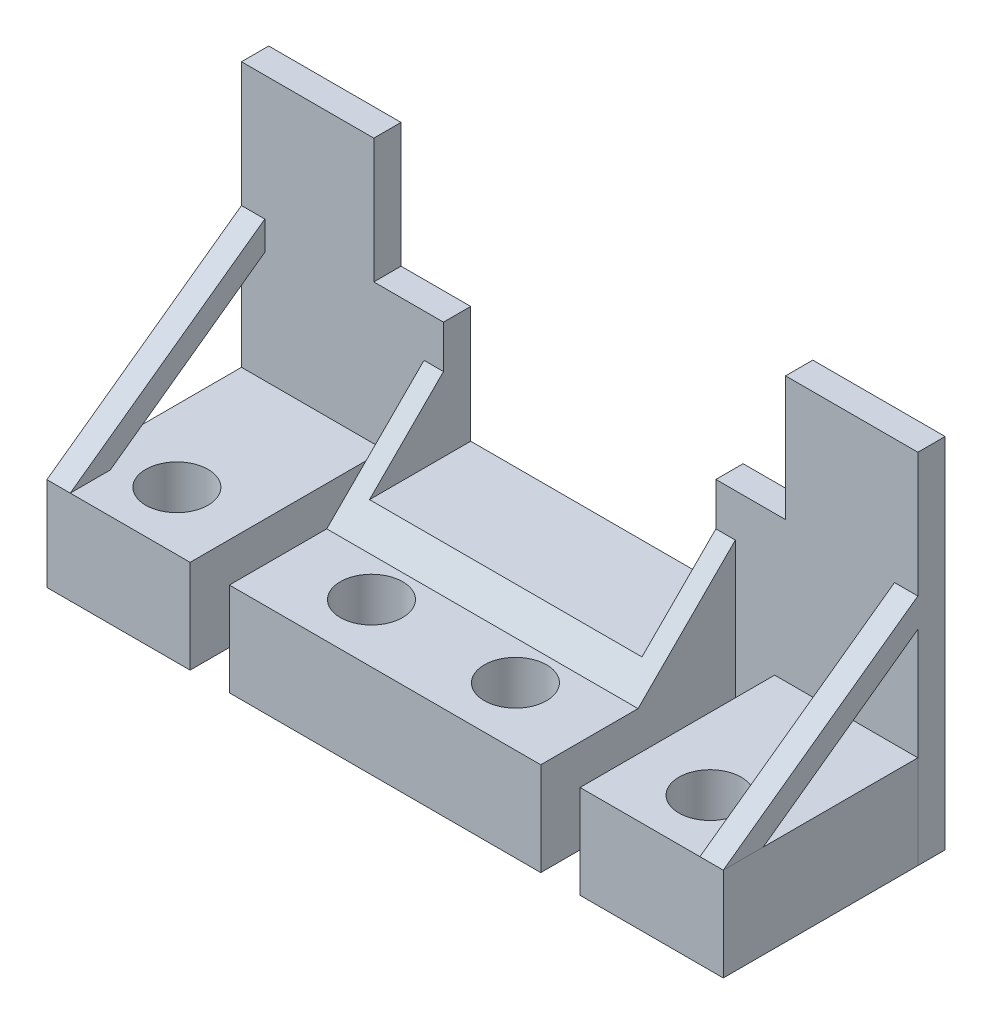
from build123d import *

# Parameters (mm, degrees)
SKETCH1_W             = 40
SKETCH1_H             = 25
SKETCH1_R             = 4
BOSS_EXTRUDE1_DEPTH   = 12
SKETCH1_W_2           = 18.4
BOSS_EXTRUDE1_2_DEPTH = 12
BOSS_EXTRUDE1_3_DEPTH = 12
BOSS_EXTRUDE2_START   = -43.45
SKETCH2_W             = 3.5
SKETCH2_H             = 30
BOSS_EXTRUDE2_DEPTH   = 86.9
BOSS_EXTRUDE3_DEPTH   = 3
BOSS_EXTRUDE4_DEPTH   = 40
CUT_EXTRUDE1_START    = -13
SKETCH5_W             = 35
SKETCH5_H             = 15
CUT_EXTRUDE1_DEPTH    = 13
SKETCH6_W             = 17
SKETCH6_H             = 3.5
BOSS_EXTRUDE5_DEPTH   = 16


with BuildPart() as part:
    # Sketch1 → Boss-Extrude1 (new body)
    with BuildSketch(Plane(origin=(0, 0, 0), x_dir=(1, 0, 0), z_dir=(0, 1, 0))):
        with Locations((20, 12.5)):
            Rectangle(SKETCH1_W, SKETCH1_H)
        with Locations(Location((10.75, 7.5, 0), (0, 0, 270))):
            Circle(SKETCH1_R, mode=Mode.SUBTRACT)
        with Locations(Location((29.25, 7.5, 0), (0, 0, 90))):
            Circle(SKETCH1_R, mode=Mode.SUBTRACT)
    extrude(amount=BOSS_EXTRUDE1_DEPTH)

    # Sketch2 → Boss-Extrude2 (add)
    with BuildSketch(Plane.ZY.offset(-20).offset(BOSS_EXTRUDE2_START)):
        with Locations((-26.75, 15)):
            Rectangle(SKETCH2_W, SKETCH2_H)
    extrude(amount=BOSS_EXTRUDE2_DEPTH)



with BuildPart() as body_2:
    # Sketch1 → Boss-Extrude1 2 (new body)
    with BuildSketch(Plane(origin=(0, 0, 0), x_dir=(1, 0, 0), z_dir=(0, 1, 0))):
        with Locations((-14.25, 12.5)):
            Rectangle(SKETCH1_W_2, SKETCH1_H)
        with Locations(Location((-14.25, 7.5, 0), (0, 0, 270))):
            Circle(SKETCH1_R, mode=Mode.SUBTRACT)
    extrude(amount=BOSS_EXTRUDE1_2_DEPTH)


with BuildPart() as body_3:
    # Sketch1 → Boss-Extrude1 3 (new body)
    with BuildSketch(Plane(origin=(0, 0, 0), x_dir=(1, 0, 0), z_dir=(0, 1, 0))):
        with Locations((54.25, 12.5)):
            Rectangle(SKETCH1_W_2, SKETCH1_H)
        with Locations(Location((54.25, 7.5, 0), (0, 0, 90))):
            Circle(SKETCH1_R, mode=Mode.SUBTRACT)
    extrude(amount=BOSS_EXTRUDE1_3_DEPTH)


with BuildPart() as part_1:
    add(part.part)

    add(body_2.part)  # Boss-Extrude3 merges body 2
    # Sketch3 → Boss-Extrude3 (add)
    with BuildSketch(Plane.ZY.offset(23.45)):
        Polygon((0, 12), (-25, 30), (-25, 26.303298768), (-5.134307267, 12), align=None)
    boss_extrude3 = extrude(amount=-BOSS_EXTRUDE3_DEPTH)

    # Mirror1: Boss-Extrude3 across plane
    add(boss_extrude3.mirror(Plane.ZY.offset(-20)))

    # Sketch4 → Boss-Extrude4 (add)
    with BuildSketch(Plane.ZY):
        Polygon((-12.5, 12), (-25, 24.5), (-25, 12), align=None)
    extrude(amount=-BOSS_EXTRUDE4_DEPTH)

    # Sketch5 → Cut-Extrude1 (cut)
    with BuildSketch(Plane(origin=(0, 0, -28.5), x_dir=(-1, 0, 0), z_dir=(0, 0, -1)).offset(CUT_EXTRUDE1_START)):
        with Locations((-20, 22.5)):
            Rectangle(SKETCH5_W, SKETCH5_H)
    extrude(amount=CUT_EXTRUDE1_DEPTH, mode=Mode.SUBTRACT)

    # Sketch6 → Boss-Extrude5 (add)
    with BuildSketch(Plane(origin=(0, 30, 0), x_dir=(1, 0, 0), z_dir=(0, 1, 0))):
        with Locations((-14.95, 26.75)):
            Rectangle(SKETCH6_W, SKETCH6_H)
    boss_extrude5 = extrude(amount=BOSS_EXTRUDE5_DEPTH)

    # Mirror2: Boss-Extrude5 across plane
    add(boss_extrude5.mirror(Plane.ZY.offset(-20)))


solid = Compound([body_3.part, part_1.part])
